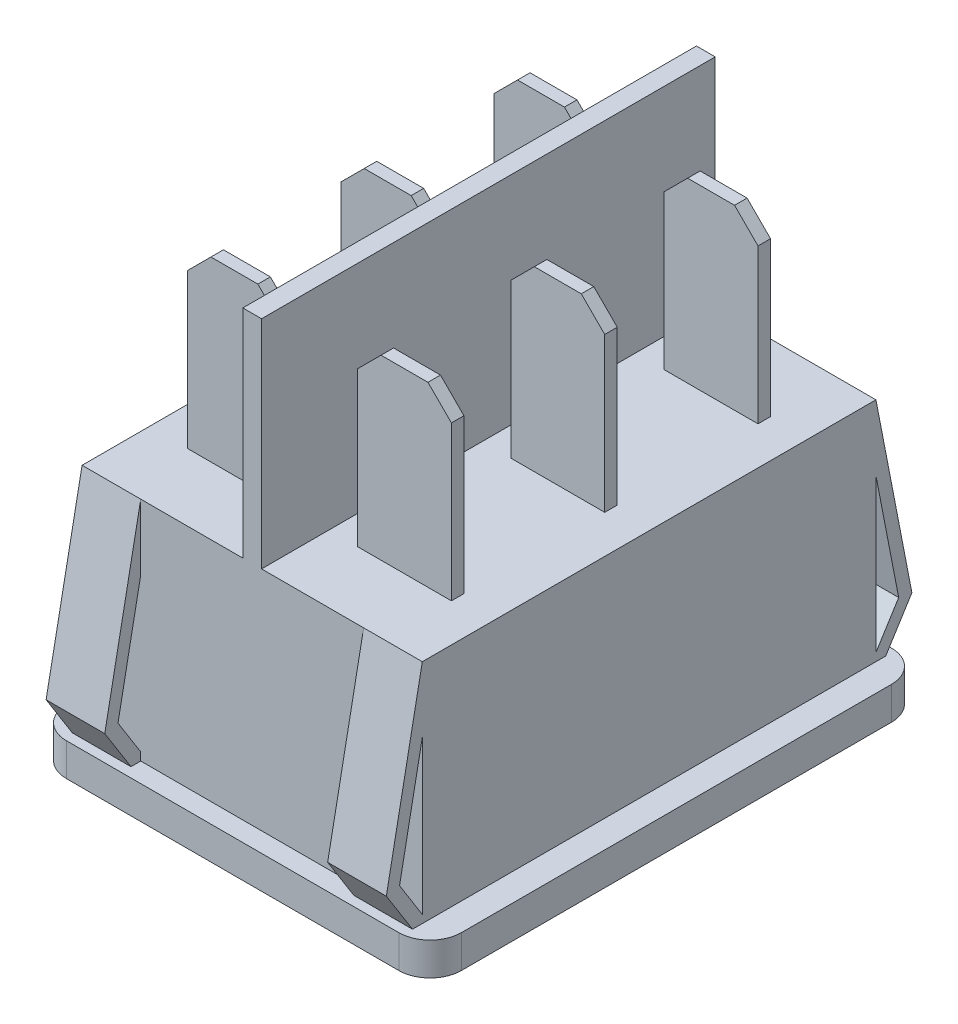
from build123d import *

# Parameters (mm, degrees)
SKETCH1_W            = 21.75
SKETCH1_H            = 29
BOSS_EXTRUDE1_DEPTH  = 16.6
SKETCH2_W            = 25.25
SKETCH2_H            = 31.5
BOSS_EXTRUDE2_DEPTH  = 2.1
SKETCH3_W            = 1.2
SKETCH3_H            = 29
BOSS_EXTRUDE3_DEPTH  = 13.85
BOSS_EXTRUDE4_START  = -3.65
BOSS_EXTRUDE4_DEPTH  = 18.3
SKETCH5_W            = 6
SKETCH5_H            = 0.8
BOSS_EXTRUDE6_DEPTH  = 11.35
CHAMFER2_SIZE        = 1.5
FILLET1_R            = 2
FILLET2_R            = 1.5
BOSS_EXTRUDE7_DEPTH  = 3.75
MIRROR2_COPY_1_DEPTH = 3.75


with BuildPart() as part:
    # Sketch1 → Boss-Extrude1 (new body)
    with BuildSketch(Plane(origin=(0, 0, 0), x_dir=(1, 0, 0), z_dir=(0, 1, 0))):
        Rectangle(SKETCH1_W, SKETCH1_H)
    extrude(amount=BOSS_EXTRUDE1_DEPTH)

    # Sketch2 → Boss-Extrude2 (add)
    with BuildSketch(Plane(origin=(0, 0, 0), x_dir=(1, 0, 0), z_dir=(0, 1, 0))):
        Rectangle(SKETCH2_W, SKETCH2_H)
    extrude(amount=BOSS_EXTRUDE2_DEPTH)

    # Sketch3 → Boss-Extrude3 (add)
    with BuildSketch(Plane(origin=(0, 16.6, 0), x_dir=(1, 0, 0), z_dir=(0, 1, 0))):
        Rectangle(SKETCH3_W, SKETCH3_H)
    extrude(amount=BOSS_EXTRUDE3_DEPTH)

    # Sketch4 → Boss-Extrude4 (add)
    with BuildSketch(Plane(origin=(12.625, 0, 0), x_dir=(0, 0, -1), z_dir=(1, 0, 0)).offset(BOSS_EXTRUDE4_START)):
        with BuildLine():
            Line((-12.25, 0), (-11.338972746, -3.4))
            ThreePointArc((-11.338972746, -3.4), (0, -1.6), (11.338972746, -3.4))
            Line((11.338972746, -3.4), (12.25, 0))
            Line((12.25, 0), (-12.25, 0))
        make_face()
    extrude(amount=-BOSS_EXTRUDE4_DEPTH)

    # Sketch5 → Boss-Extrude6 (add)
    with BuildSketch(Plane(origin=(0, 16.6, 0), x_dir=(1, 0, 0), z_dir=(0, 1, 0))):
        with Locations((5.4375, 9.8)):
            Rectangle(SKETCH5_W, SKETCH5_H)
        with Locations((5.4375, 0)):
            Rectangle(SKETCH5_W, SKETCH5_H)
        with Locations((5.4375, -9.8)):
            Rectangle(SKETCH5_W, SKETCH5_H)
        with Locations((-5.4375, -9.8)):
            Rectangle(SKETCH5_W, SKETCH5_H)
        with Locations((-5.4375, 0)):
            Rectangle(SKETCH5_W, SKETCH5_H)
        with Locations((-5.4375, 9.8)):
            Rectangle(SKETCH5_W, SKETCH5_H)
    extrude(amount=BOSS_EXTRUDE6_DEPTH)

    # Chamfer2
    chamfer2_edges = [part.edges().sort_by_distance(p)[0] for p in [
        (-2.4375, 27.95, 0),
        (-8.4375, 27.95, 0),
        (-2.4375, 27.95, -9.8),
        (-8.4375, 27.95, -9.8),
        (8.4375, 27.95, 0),
        (2.4375, 27.95, 0),
        (-2.4375, 27.95, 9.8),
        (-8.4375, 27.95, 9.8),
        (2.4375, 27.95, -9.8),
        (8.4375, 27.95, -9.8),
        (2.4375, 27.95, 9.8),
        (8.4375, 27.95, 9.8),
    ]]
    chamfer(chamfer2_edges, length=CHAMFER2_SIZE)

    # Fillet1
    fillet1_edges = [part.edges().sort_by_distance(p)[0] for p in [
        (12.625, 1.05, 15.75),
        (12.625, 1.05, -15.75),
        (-12.625, 1.05, -15.75),
        (-12.625, 1.05, 15.75),
    ]]
    fillet(fillet1_edges, radius=FILLET1_R)

    # Fillet2
    fillet2_edges = [part.edges().sort_by_distance(p)[0] for p in [
        (-0.175, -3.4, -11.338972746),
        (-0.175, -3.4, 11.338972746),
    ]]
    fillet(fillet2_edges, radius=FILLET2_R)

    # Sketch6 → Boss-Extrude7 (add)
    with BuildSketch(Plane.ZY.offset(10.875)):
        Polygon((-14.5, 16.6), (-16.8, 4.767525763), (-15.125, 2.1), (-14.5, 2.1), (-14.5, 2.609042619), (-15.954375498, 4.925212238), (-14.5, 12.407325549), align=None)
    boss_extrude7 = extrude(amount=-BOSS_EXTRUDE7_DEPTH)

    # Mirror1: Boss-Extrude7 across plane
    add(boss_extrude7.mirror(Plane(origin=(0, 0, 0), x_dir=(0, 0, 1), z_dir=(1, 0, 0))))

    # Mirror2: Boss-Extrude7 across plane
    add(boss_extrude7.mirror(Plane.XY))

    # Mirror2 copy 1 sketch → Mirror2 copy 1 (add)
    with BuildSketch(Plane(origin=(10.875, 0, 0), x_dir=(0, 0, -1), z_dir=(1, 0, 0))):
        Polygon((-14.5, 16.6), (-16.8, 4.767525763), (-15.125, 2.1), (-14.5, 2.1), (-14.5, 2.609042619), (-15.954375498, 4.925212238), (-14.5, 12.407325549), align=None)
    extrude(amount=-MIRROR2_COPY_1_DEPTH)


solid = part.part
